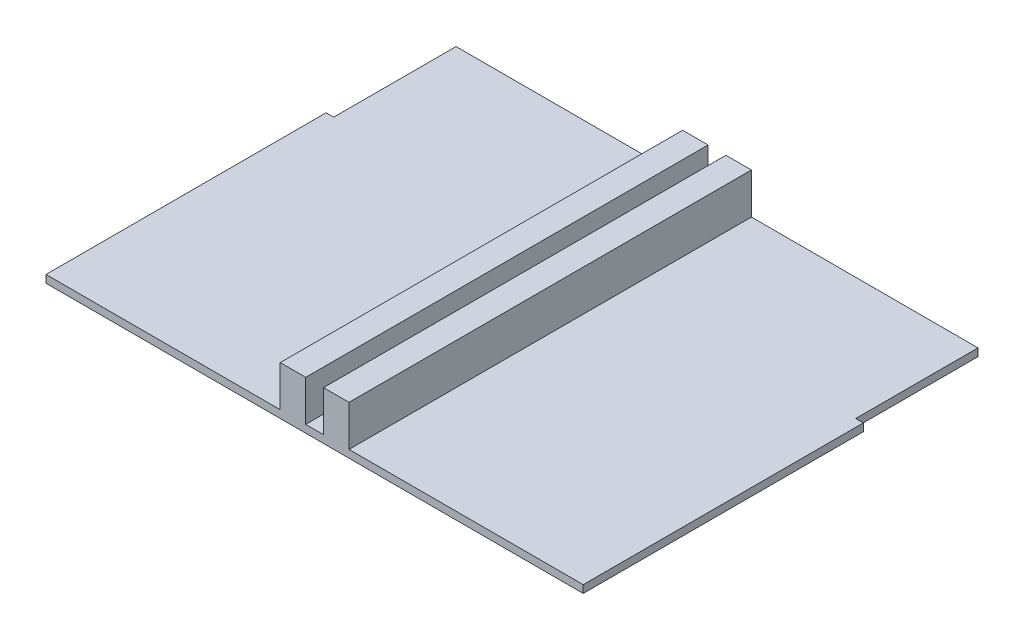
from build123d import *

# Parameters (mm, degrees)
SKETCH1_W           = 9.89
SKETCH1_H           = 4.79
SKETCH1_H_2         = 0.01
SKETCH1_W_2         = 0.01
SKETCH1_H_3         = 10.99
SKETCH1_W_3         = 0.29
BOSS_EXTRUDE1_DEPTH = 0.3
SKETCH2_W           = 1
SKETCH2_H           = 15.79
BOSS_EXTRUDE2_DEPTH = 1.6


with BuildPart() as part:
    # Sketch1 → Boss-Extrude1 (new body)
    with BuildSketch(Plane(origin=(0, 0, 0), x_dir=(1, 0, 0), z_dir=(0, 1, 0))):
        with Locations((-5.295, 13.395)):
            Rectangle(SKETCH1_W, SKETCH1_H)
        with Locations((5.295, 13.395)):
            Rectangle(SKETCH1_W, SKETCH1_H)
        with Locations((-5.295, 10.995)):
            Rectangle(SKETCH1_W, SKETCH1_H_2)
        with Locations((5.295, 10.995)):
            Rectangle(SKETCH1_W, SKETCH1_H_2)
        Polygon((-0.35, 11), (-0.35, 10.99), (0.35, 10.99), (0.35, 11), (0.34, 11), (-0.34, 11), align=None)
        Polygon((-10.24, 10.99), (-10.24, 0), (10.24, 0), (10.24, 10.99), (0.35, 10.99), (-0.35, 10.99), align=None)
        with Locations((-10.245, 5.495)):
            Rectangle(SKETCH1_W_2, SKETCH1_H_3)
        with Locations((-10.395, 5.495)):
            Rectangle(SKETCH1_W_3, SKETCH1_H_3)
        with Locations((10.395, 5.495)):
            Rectangle(SKETCH1_W_3, SKETCH1_H_3)
        with Locations((10.245, 5.495)):
            Rectangle(SKETCH1_W_2, SKETCH1_H_3)
    extrude(amount=BOSS_EXTRUDE1_DEPTH)

    # Sketch2 → Boss-Extrude2 (add)
    with BuildSketch(Plane(origin=(0, 0.3, 0), x_dir=(1, 0, 0), z_dir=(0, 1, 0))):
        with Locations((-0.85, 7.895)):
            Rectangle(SKETCH2_W, SKETCH2_H)
        with Locations((0.85, 7.895)):
            Rectangle(SKETCH2_W, SKETCH2_H)
    extrude(amount=BOSS_EXTRUDE2_DEPTH)


solid = part.part
